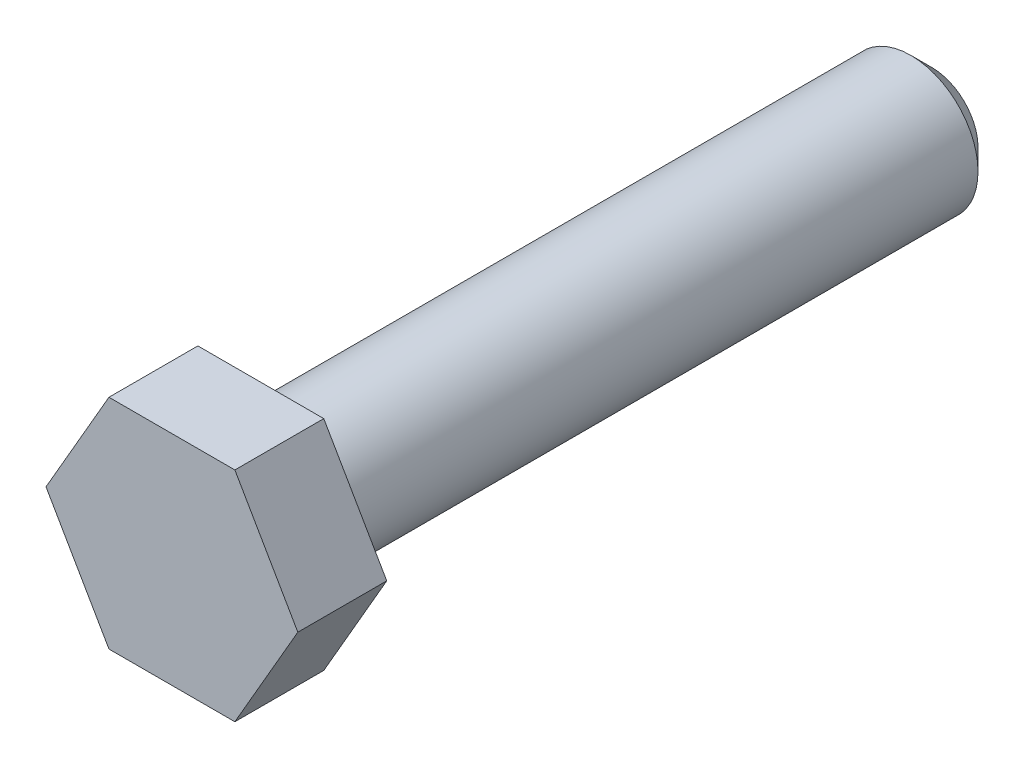
from build123d import *

# Parameters (mm, degrees)
BASE_EXTRUDE_DEPTH  = 5.3
SKETCH3_R           = 4
BOSS_EXTRUDE1_DEPTH = 40
CHAMFER1_SIZE       = 1.25


with BuildPart() as part:
    # Sketch1 → Base-Extrude (new body)
    with BuildSketch(Plane.XY):
        Polygon((-3.75277675, 6.5), (3.75277675, 6.5), (7.505553499, 0), (3.75277675, -6.5), (-3.75277675, -6.5), (-7.505553499, 0), align=None)
    extrude(amount=BASE_EXTRUDE_DEPTH)

    # Sketch3 → Boss-Extrude1 (add)
    with BuildSketch(Plane(origin=(0, 0, 0), x_dir=(-1, 0, 0), z_dir=(0, 0, -1))):
        with Locations(Location((0, 0, 0), (0, 0, 180))):
            Circle(SKETCH3_R)
    extrude(amount=BOSS_EXTRUDE1_DEPTH)

    # Chamfer1
    chamfer1_edges = [part.edges().sort_by_distance(p)[0] for p in [
        (-4, 0, -40),
    ]]
    chamfer(chamfer1_edges, length=CHAMFER1_SIZE)


solid = part.part
